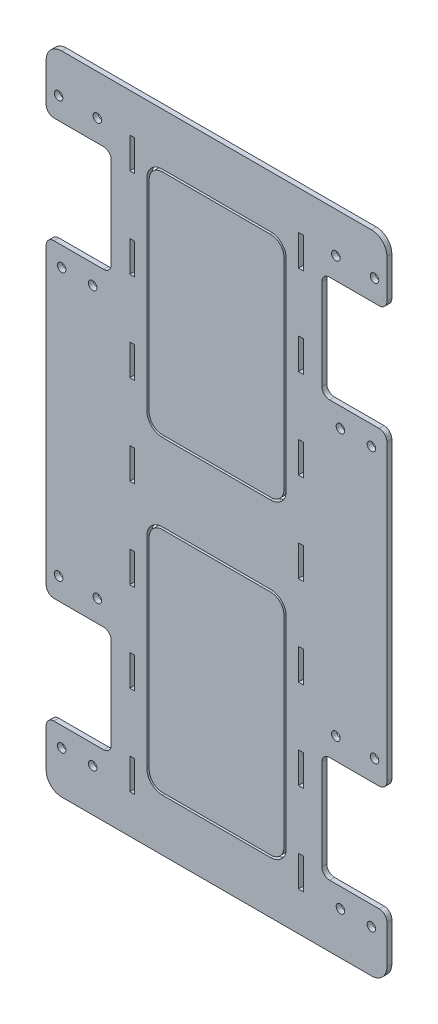
from build123d import *

# Parameters (mm, degrees)
BOSS_EXTRU_1_DEPTH       = 3.175
ESQUISSE2_W              = 3.175
ESQUISSE2_H              = 20
ENL_V_MAT_EXTRU_1_DEPTH  = 236.847494422
D_GAGEMENT_M51_D         = 5.5
CONG_1_R                 = 5
CONG_2_R                 = 10
SPLIT1_SURFACE_1_1_BACK  = 472.663
SPLIT1_SURFACE_1_1_DEPTH = 945.326
SPLIT1_SURFACE_1_2_BACK  = 472.663
SPLIT1_SURFACE_1_2_DEPTH = 945.326
SPLIT1_SURFACE_2_3_BACK  = 472.663
SPLIT1_SURFACE_2_3_DEPTH = 945.326
SPLIT1_SURFACE_2_4_BACK  = 472.663
SPLIT1_SURFACE_2_4_DEPTH = 945.326
CUT_EXTRUDE2_DEPTH       = 236.847494422
CUT_EXTRUDE2_DEPTH_BACK  = 3.175
CUT_EXTRUDE3_START       = -3.175
CUT_EXTRUDE3_DEPTH       = 3.175


with BuildPart() as part:
    # Esquisse1 → Boss.-Extru.1 (new body)
    with BuildSketch(Plane.XY):
        Polygon((110, 208.6), (-110, 208.6), (-110, 168.6), (-68, 168.6), (-68, 100), (-110, 100), (-110, -100), (-68, -100), (-68, -168.6), (-110, -168.6), (-110, -208.6), (110, -208.6), (110, -168.6), (68, -168.6), (68, -100), (110, -100), (110, 100), (68, 100), (68, 168.6), (110, 168.6), align=None)
    extrude(amount=BOSS_EXTRU_1_DEPTH)

    # Esquisse2 → Enlèv. mat.-Extru.1 (cut, symmetric)
    with BuildSketch(Plane.XY.offset(3.175)):
        with Locations((-54.4125, 173.6)):
            Rectangle(ESQUISSE2_W, ESQUISSE2_H)
        with Locations((-54.4125, 115.733333333)):
            Rectangle(ESQUISSE2_W, ESQUISSE2_H)
        with Locations((-54.4125, 57.866666667)):
            Rectangle(ESQUISSE2_W, ESQUISSE2_H)
        with Locations((-54.4125, 0)):
            Rectangle(ESQUISSE2_W, ESQUISSE2_H)
        with Locations((-54.4125, -57.866666667)):
            Rectangle(ESQUISSE2_W, ESQUISSE2_H)
        with Locations((-54.4125, -115.733333333)):
            Rectangle(ESQUISSE2_W, ESQUISSE2_H)
        with Locations((-54.4125, -173.6)):
            Rectangle(ESQUISSE2_W, ESQUISSE2_H)
    enl_v_mat_extru_1 = extrude(amount=ENL_V_MAT_EXTRU_1_DEPTH, both=True, mode=Mode.SUBTRACT)

    # Symétrie1: Enlèv. mat.-Extru.1 across plane
    add(enl_v_mat_extru_1.mirror(Plane(origin=(0, 0, 0), x_dir=(0, 0, 1), z_dir=(1, 0, 0))), mode=Mode.SUBTRACT)

    # Dégagement M51 (through all)
    with Locations(Plane(origin=(100, -181.1, 3.175), x_dir=(1, 0, 0), z_dir=(0, 0, 1))):
        with Locations((0, 0), (-20, 0), (-200, 0), (-180, 0), (-202, 95.1), (-177, 95.1), (-23, 95.1), (2, 95.1), (-20, 268.6), (0, 268.6), (-23, 363.7), (2, 363.7), (-200, 268.6), (-180, 268.6), (-202, 363.7), (-177, 363.7)):
            Hole(D_GAGEMENT_M51_D / 2)

    # Congé1
    cong_1_edges = [part.edges().sort_by_distance(p)[0] for p in [
        (110, 168.6, 1.5875),
        (68, 168.6, 1.5875),
        (68, 100, 1.5875),
        (110, 100, 1.5875),
        (110, -100, 1.5875),
        (68, -100, 1.5875),
        (68, -168.6, 1.5875),
        (110, -168.6, 1.5875),
        (-110, -168.6, 1.5875),
        (-68, -168.6, 1.5875),
        (-68, -100, 1.5875),
        (-110, -100, 1.5875),
        (-110, 100, 1.5875),
        (-68, 100, 1.5875),
        (-68, 168.6, 1.5875),
        (-110, 168.6, 1.5875),
    ]]
    fillet(cong_1_edges, radius=CONG_1_R)

    # Congé2
    cong_2_edges = [part.edges().sort_by_distance(p)[0] for p in [
        (110, -208.6, 1.5875),
        (-110, -208.6, 1.5875),
        (-110, 208.6, 1.5875),
        (110, 208.6, 1.5875),
    ]]
    fillet(cong_2_edges, radius=CONG_2_R)


with BuildPart() as body_2:
    # Split1: the piece behind the surface
    add(part.part)
    # Split1 surface 1: a surface, the sketch's curves swept straight by 945.326 mm
    with BuildLine(Plane.XY.offset(3.175).offset(-SPLIT1_SURFACE_1_1_BACK), mode=Mode.PRIVATE) as split1_surface_1_1_path:
        ThreePointArc((35, -25), (42.071067812, -27.928932188), (45, -35))
        Line((45, -35), (45, -165))
        ThreePointArc((45, -165), (42.071067812, -172.071067812), (35, -175))
        Line((35, -175), (-35, -175))
        ThreePointArc((-35, -175), (-42.071067812, -172.071067812), (-45, -165))
        Line((-45, -165), (-45, -35))
        ThreePointArc((-45, -35), (-42.071067812, -27.928932188), (-35, -25))
        Line((-35, -25), (35, -25))
    split1_surface_1_1 = Shell.extrude(split1_surface_1_1_path.wire(), (0 * SPLIT1_SURFACE_1_1_DEPTH, 0 * SPLIT1_SURFACE_1_1_DEPTH, 1 * SPLIT1_SURFACE_1_1_DEPTH))
    split(bisect_by=split1_surface_1_1, keep=Keep.BOTTOM)

    # Sketch6 → Cut-Extrude3 (cut)
    with BuildSketch(Plane.XY.offset(3.175).offset(CUT_EXTRUDE3_START)):
        with BuildLine():
            Line((-45, -35), (-45, -165))
            ThreePointArc((-45, -165), (-42.071067812, -172.071067812), (-35, -175))
            Line((-35, -175), (35, -175))
            ThreePointArc((35, -175), (42.071067812, -172.071067812), (45, -165))
            Line((45, -165), (45, -35))
            ThreePointArc((45, -35), (42.071067812, -27.928932188), (35, -25))
            Line((35, -25), (-35, -25))
            ThreePointArc((-35, -25), (-42.071067812, -27.928932188), (-45, -35))
        make_face()
        with BuildLine():
            Line((-43.5, -35), (-43.5, -165))
            ThreePointArc((-43.5, -165), (-41.01040764, -171.01040764), (-35, -173.5))
            Line((-35, -173.5), (35, -173.5))
            ThreePointArc((35, -173.5), (41.01040764, -171.01040764), (43.5, -165))
            Line((43.5, -165), (43.5, -35))
            ThreePointArc((43.5, -35), (41.01040764, -28.98959236), (35, -26.5))
            Line((35, -26.5), (-35, -26.5))
            ThreePointArc((-35, -26.5), (-41.01040764, -28.98959236), (-43.5, -35))
        make_face(mode=Mode.SUBTRACT)
    extrude(amount=CUT_EXTRUDE3_DEPTH, mode=Mode.SUBTRACT)


with BuildPart() as part_1:
    add(part.part)

    # Split1: split by a surface, the side it looks to stays
    # Split1 surface 1: a surface, the sketch's curves swept straight by 945.326 mm
    with BuildLine(Plane.XY.offset(3.175).offset(-SPLIT1_SURFACE_1_2_BACK), mode=Mode.PRIVATE) as split1_surface_1_2_path:
        ThreePointArc((35, -25), (42.071067812, -27.928932188), (45, -35))
        Line((45, -35), (45, -165))
        ThreePointArc((45, -165), (42.071067812, -172.071067812), (35, -175))
        Line((35, -175), (-35, -175))
        ThreePointArc((-35, -175), (-42.071067812, -172.071067812), (-45, -165))
        Line((-45, -165), (-45, -35))
        ThreePointArc((-45, -35), (-42.071067812, -27.928932188), (-35, -25))
        Line((-35, -25), (35, -25))
    split1_surface_1_2 = Shell.extrude(split1_surface_1_2_path.wire(), (0 * SPLIT1_SURFACE_1_2_DEPTH, 0 * SPLIT1_SURFACE_1_2_DEPTH, 1 * SPLIT1_SURFACE_1_2_DEPTH))
    split(bisect_by=split1_surface_1_2, keep=Keep.TOP)


with BuildPart() as body_3:
    # Split1 2: the piece behind the surface
    add(part_1.part)
    # Split1 surface 2: a surface, the sketch's curves swept straight by 945.326 mm
    with BuildLine(Plane.XY.offset(3.175).offset(-SPLIT1_SURFACE_2_3_BACK), mode=Mode.PRIVATE) as split1_surface_2_3_path:
        ThreePointArc((-35, 25), (-42.071067812, 27.928932188), (-45, 35))
        Line((-45, 35), (-45, 165))
        ThreePointArc((-45, 165), (-42.071067812, 172.071067812), (-35, 175))
        Line((-35, 175), (35, 175))
        ThreePointArc((35, 175), (42.071067812, 172.071067812), (45, 165))
        Line((45, 165), (45, 35))
        ThreePointArc((45, 35), (42.071067812, 27.928932188), (35, 25))
        Line((35, 25), (-35, 25))
    split1_surface_2_3 = Shell.extrude(split1_surface_2_3_path.wire(), (0 * SPLIT1_SURFACE_2_3_DEPTH, 0 * SPLIT1_SURFACE_2_3_DEPTH, 1 * SPLIT1_SURFACE_2_3_DEPTH))
    split(bisect_by=split1_surface_2_3, keep=Keep.BOTTOM)

    # Sketch3 → Cut-Extrude2 (cut, two sides: drawn at the far end of the back side and taken through both)
    with BuildSketch(Plane.XY.offset(3.175).offset(-CUT_EXTRUDE2_DEPTH_BACK)):
        with BuildLine():
            Line((45, 35), (45, 165))
            ThreePointArc((45, 165), (42.071067812, 172.071067812), (35, 175))
            Line((35, 175), (-35, 175))
            ThreePointArc((-35, 175), (-42.071067812, 172.071067812), (-45, 165))
            Line((-45, 165), (-45, 35))
            ThreePointArc((-45, 35), (-42.071067812, 27.928932188), (-35, 25))
            Line((-35, 25), (35, 25))
            ThreePointArc((35, 25), (42.071067812, 27.928932188), (45, 35))
        make_face()
        with BuildLine():
            Line((43.5, 35), (43.5, 165))
            ThreePointArc((43.5, 165), (41.01040764, 171.01040764), (35, 173.5))
            Line((35, 173.5), (-35, 173.5))
            ThreePointArc((-35, 173.5), (-41.01040764, 171.01040764), (-43.5, 165))
            Line((-43.5, 165), (-43.5, 35))
            ThreePointArc((-43.5, 35), (-41.01040764, 28.98959236), (-35, 26.5))
            Line((-35, 26.5), (35, 26.5))
            ThreePointArc((35, 26.5), (41.01040764, 28.98959236), (43.5, 35))
        make_face(mode=Mode.SUBTRACT)
    extrude(amount=CUT_EXTRUDE2_DEPTH + CUT_EXTRUDE2_DEPTH_BACK, mode=Mode.SUBTRACT)


with BuildPart() as part_2:
    add(part_1.part)

    # Split1 2: split by a surface, the side it looks to stays
    # Split1 surface 2: a surface, the sketch's curves swept straight by 945.326 mm
    with BuildLine(Plane.XY.offset(3.175).offset(-SPLIT1_SURFACE_2_4_BACK), mode=Mode.PRIVATE) as split1_surface_2_4_path:
        ThreePointArc((-35, 25), (-42.071067812, 27.928932188), (-45, 35))
        Line((-45, 35), (-45, 165))
        ThreePointArc((-45, 165), (-42.071067812, 172.071067812), (-35, 175))
        Line((-35, 175), (35, 175))
        ThreePointArc((35, 175), (42.071067812, 172.071067812), (45, 165))
        Line((45, 165), (45, 35))
        ThreePointArc((45, 35), (42.071067812, 27.928932188), (35, 25))
        Line((35, 25), (-35, 25))
    split1_surface_2_4 = Shell.extrude(split1_surface_2_4_path.wire(), (0 * SPLIT1_SURFACE_2_4_DEPTH, 0 * SPLIT1_SURFACE_2_4_DEPTH, 1 * SPLIT1_SURFACE_2_4_DEPTH))
    split(bisect_by=split1_surface_2_4, keep=Keep.TOP)


solid = Compound([body_2.part, body_3.part, part_2.part])
